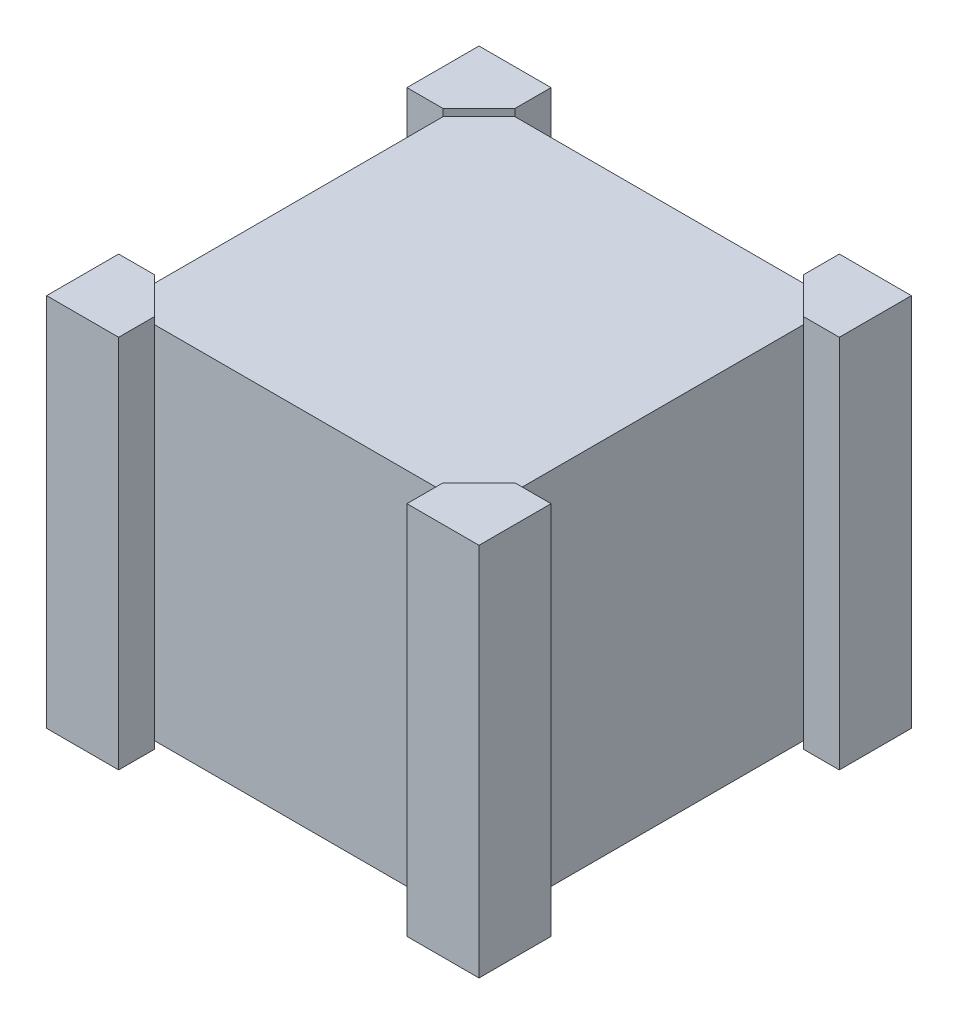
from build123d import *

# Parameters (mm, degrees)
SKETCH1_W           = 12.7
SKETCH1_H           = 12.7
BOSS_EXTRUDE1_DEPTH = 127
BOSS_EXTRUDE2_DEPTH = 2.54


with BuildPart() as part:
    # Sketch1 → Boss-Extrude1 (new body)
    with BuildSketch(Plane(origin=(0, 0, 0), x_dir=(1, 0, 0), z_dir=(0, 1, 0))):
        Polygon((50.8, 63.5), (-50.8, 63.5), (-50.8, 50.8), (-63.5, 50.8), (-63.5, -50.8), (-50.8, -50.8), (-50.8, -63.5), (50.8, -63.5), (50.8, -50.8), (63.5, -50.8), (63.5, 50.8), (50.8, 50.8), align=None)
        with Locations((-57.15, -57.15)):
            Rectangle(SKETCH1_W, SKETCH1_H)
        Polygon((-63.5, -63.5), (-63.5, -50.8), (-76.2, -50.8), (-76.2, -76.2), (-50.8, -76.2), (-50.8, -63.5), align=None)
        with Locations((57.15, -57.15)):
            Rectangle(SKETCH1_W, SKETCH1_H)
        Polygon((76.2, -50.8), (63.5, -50.8), (63.5, -63.5), (50.8, -63.5), (50.8, -76.2), (76.2, -76.2), align=None)
        with Locations((57.15, 57.15)):
            Rectangle(SKETCH1_W, SKETCH1_H)
        Polygon((50.8, 76.2), (50.8, 63.5), (63.5, 63.5), (63.5, 50.8), (76.2, 50.8), (76.2, 76.2), align=None)
        Polygon((-63.5, 50.8), (-63.5, 63.5), (-50.8, 63.5), (-50.8, 76.2), (-76.2, 76.2), (-76.2, 50.8), align=None)
        with Locations((-57.15, 57.15)):
            Rectangle(SKETCH1_W, SKETCH1_H)
    extrude(amount=BOSS_EXTRUDE1_DEPTH)

    # Sketch2 → Boss-Extrude2 (add)
    with BuildSketch(Plane.XZ):
        Polygon((50.8, 63.5), (63.5, 50.8), (76.2, 50.8), (76.2, 76.2), (50.8, 76.2), align=None)
        Polygon((63.5, -50.8), (50.8, -63.5), (50.8, -76.2), (76.2, -76.2), (76.2, -50.8), align=None)
        Polygon((-63.5, -50.8), (-50.8, -63.5), (-50.8, -76.2), (-76.2, -76.2), (-76.2, -50.8), align=None)
        Polygon((-63.5, 50.8), (-50.8, 63.5), (-50.8, 76.2), (-76.2, 76.2), (-76.2, 50.8), align=None)
    boss_extrude2 = extrude(amount=BOSS_EXTRUDE2_DEPTH)

    # Mirror1: Boss-Extrude2 across plane
    add(boss_extrude2.mirror(Plane.ZX.offset(63.5)))


solid = part.part
